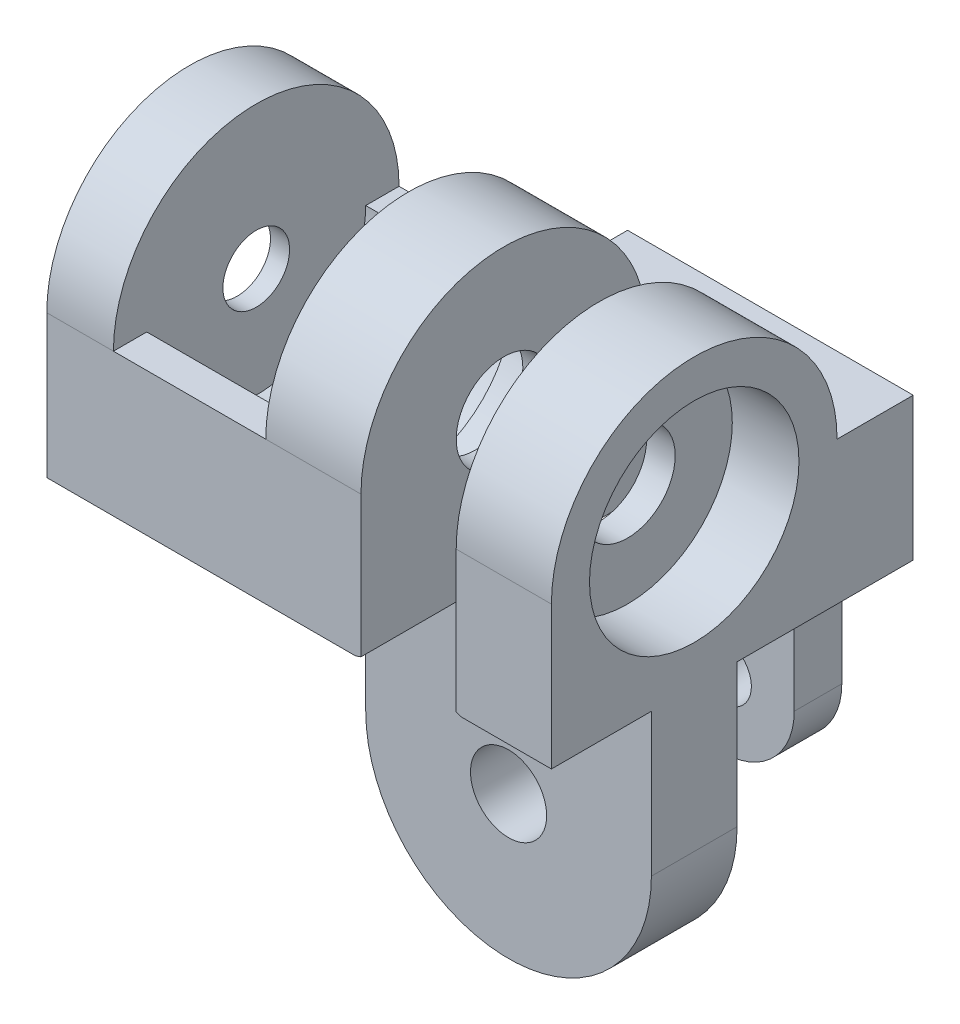
from build123d import *

# Parameters (mm, degrees)
SKETCH1_R           = 15
BOSS_EXTRUDE1_DEPTH = 30
SKETCH8_W           = 30
SKETCH8_H           = 15
REVOLVE1_ANGLE      = 180
SKETCH9_W           = 30
SKETCH9_H           = 30
BOSS_EXTRUDE3_DEPTH = 15
SKETCH10_R          = 5
CUT_EXTRUDE1_DEPTH  = 30
SKETCH13_R          = 16
CUT_EXTRUDE2_DEPTH  = 10
SKETCH14_W          = 10
SKETCH14_H          = 15
CUT_EXTRUDE3_DEPTH  = 67
CUT_EXTRUDE4_START  = -7
SKETCH15_R          = 11
SKETCH15_R_2        = 5
CUT_EXTRUDE4_DEPTH  = 7
SKETCH16_R          = 11
SKETCH16_R_2        = 5
CUT_EXTRUDE5_DEPTH  = 7
SKETCH17_R          = 15
SKETCH17_R_2        = 8
SKETCH17_R_3        = 3.5
BOSS_EXTRUDE4_DEPTH = 2
BOSS_EXTRUDE5_DEPTH = 5
BOSS_EXTRUDE6_DEPTH = 16
SKETCH21_W          = 53
SKETCH21_H          = 30
CUT_EXTRUDE7_DEPTH  = 20
SKETCH23_W          = 15
SKETCH23_H          = 9
SKETCH24_W          = 30
SKETCH24_H          = 9
BOSS_EXTRUDE7_DEPTH = 15
SKETCH25_R          = 4
CUT_EXTRUDE8_DEPTH  = 15
BOSS_EXTRUDE8_START = 3
SKETCH26_W          = 10
SKETCH26_H          = 15
BOSS_EXTRUDE8_DEPTH = 5
SKETCH30_W          = 30
SKETCH30_H          = 15
BOSS_EXTRUDE9_DEPTH = 3
SKETCH27_R          = 16
CUT_EXTRUDE9_DEPTH  = 16
SKETCH28_R          = 16
CUT_EXTRUDE10_DEPTH = 10.5
SKETCH29_R          = 16
CUT_EXTRUDE12_DEPTH = 10


with BuildPart() as part:
    # Sketch1 → Boss-Extrude1 (new body)
    with BuildSketch(Plane(origin=(0, 0, 0), x_dir=(1, 0, 0), z_dir=(0, 1, 0))):
        with Locations(Location((0, 0, 0), (0, 0, 270))):
            Circle(SKETCH1_R)
    extrude(amount=BOSS_EXTRUDE1_DEPTH)

    # Sketch8 → Revolve1 (revolve)
    with BuildSketch(Plane(origin=(0, 30, 0), x_dir=(1, 0, 0), z_dir=(0, 1, 0))):
        with Locations((0, -7.5)):
            Rectangle(SKETCH8_W, SKETCH8_H)
    revolve(axis=Axis((15, 30, 0), (-1, 0, 0)), revolution_arc=REVOLVE1_ANGLE)

    # Sketch9 → Boss-Extrude3 (add)
    with BuildSketch(Plane.XZ.offset(-30)):
        Rectangle(SKETCH9_W, SKETCH9_H)
    extrude(amount=BOSS_EXTRUDE3_DEPTH)

    # Sketch10 → Cut-Extrude1 (cut)
    with BuildSketch(Plane(origin=(15, 0, 0), x_dir=(0, 0, -1), z_dir=(1, 0, 0))):
        with Locations((0, 30)):
            Circle(SKETCH10_R)
    extrude(amount=-CUT_EXTRUDE1_DEPTH, mode=Mode.SUBTRACT)

    # Sketch13 → Cut-Extrude2 (cut)
    with BuildSketch(Plane(origin=(5, 0, 0), x_dir=(0, 0, -1), z_dir=(1, 0, 0))):
        with Locations((0, 30)):
            Circle(SKETCH13_R)
    extrude(amount=-CUT_EXTRUDE2_DEPTH, mode=Mode.SUBTRACT)

    # Sketch14 → Cut-Extrude3 (cut)
    with BuildSketch(Plane.XY.offset(15)):
        with Locations((0, 22.5)):
            Rectangle(SKETCH14_W, SKETCH14_H)
    extrude(amount=-CUT_EXTRUDE3_DEPTH, mode=Mode.SUBTRACT)

    # Sketch15 → Cut-Extrude4 (cut)
    with BuildSketch(Plane.ZY.offset(15).offset(CUT_EXTRUDE4_START)):
        with Locations((0, 30)):
            Circle(SKETCH15_R)
        with Locations(Location((0, 30, 0), (0, 0, 180))):
            Circle(SKETCH15_R_2, mode=Mode.SUBTRACT)
    extrude(amount=CUT_EXTRUDE4_DEPTH, mode=Mode.SUBTRACT)

    # Sketch16 → Cut-Extrude5 (cut)
    with BuildSketch(Plane(origin=(15, 0, 0), x_dir=(0, 0, -1), z_dir=(1, 0, 0))):
        with Locations(Location((0, 30, 0), (0, 0, 180))):
            Circle(SKETCH16_R)
        with Locations((0, 30)):
            Circle(SKETCH16_R_2, mode=Mode.SUBTRACT)
    extrude(amount=-CUT_EXTRUDE5_DEPTH, mode=Mode.SUBTRACT)



with BuildPart() as body_2:
    # Sketch17 → Boss-Extrude4 (new body)
    # profile 1 of 4: a face of its own
    with BuildSketch(Plane.ZY.offset(31)):
        with Locations((0, 30)):
            Circle(SKETCH17_R)
        with Locations((0, 30)):
            Circle(SKETCH17_R_2, mode=Mode.SUBTRACT)
    # profile 2 of 4: a face of its own
    with BuildSketch(Plane.ZY.offset(31)):
        with Locations((0, 30)):
            Circle(SKETCH17_R_2)
        with Locations((0, 30)):
            Circle(SKETCH17_R_3, mode=Mode.SUBTRACT)
    # profile 3 of 4: a face of its own
    with BuildSketch(Plane.ZY.offset(31)):
        with BuildLine():
            ThreePointArc((0, 15), (-10.606601718, 19.393398282), (-15, 30))
            Line((-15, 30), (-15, 15))
            Line((-15, 15), (0, 15))
        make_face()
    # profile 4 of 4: a face of its own
    with BuildSketch(Plane.ZY.offset(31)):
        with BuildLine():
            Line((15, 15), (15, 30))
            ThreePointArc((15, 30), (10.606601718, 19.393398282), (0, 15))
            Line((0, 15), (15, 15))
        make_face()
    extrude(amount=BOSS_EXTRUDE4_DEPTH)

    # Sketch18 → Boss-Extrude5 (add)
    with BuildSketch(Plane.ZY.offset(33)):
        with BuildLine():
            ThreePointArc((-8.5, 30), (0, 38.5), (8.5, 30))
            Line((8.5, 30), (8.5, 15))
            Line((8.5, 15), (15, 15))
            Line((15, 15), (15, 30))
            ThreePointArc((15, 30), (0, 45), (-15, 30))
            Line((-15, 30), (-15, 15))
            Line((-15, 15), (-8.5, 15))
            Line((-8.5, 15), (-8.5, 30))
        make_face()
    extrude(amount=BOSS_EXTRUDE5_DEPTH)


with BuildPart() as part_1:
    add(part.part)

    add(body_2.part)  # Boss-Extrude6 merges body 2
    # Sketch20 → Boss-Extrude6 (add)
    with BuildSketch(Plane.ZY.offset(15)):
        with BuildLine():
            ThreePointArc((11.5, 30), (0, 18.5), (-11.5, 30))
            Line((-11.5, 30), (-15, 30))
            Line((-15, 30), (-15, 15))
            Line((-15, 15), (0, 15))
            Line((0, 15), (15, 15))
            Line((15, 15), (15, 30))
            Line((15, 30), (11.5, 30))
        make_face()
    extrude(amount=BOSS_EXTRUDE6_DEPTH)

    # Sketch21 → Cut-Extrude7 (cut)
    with BuildSketch(Plane.XZ.offset(-15)):
        with Locations((-11.5, 0)):
            Rectangle(SKETCH21_W, SKETCH21_H)
    extrude(amount=CUT_EXTRUDE7_DEPTH, mode=Mode.SUBTRACT)


with BuildPart() as cut_extrude7_piece_1:
    # of the separate pieces the step leaves, piece 1, a body of its own (cut_extrude7_pieces)
    add(part_1.part.solids().sort_by_distance((-31, 30, 15))[0])



with BuildPart() as cut_extrude7_piece_2:
    # of the separate pieces the step leaves, piece 2, a body of its own (cut_extrude7_pieces)
    add(part_1.part.solids().sort_by_distance((5, 15, -15))[0])


with BuildPart() as body_3:
    # Sketch23 → Revolve2 (revolve)
    with BuildSketch(Plane(origin=(0, 0, 0), x_dir=(-1, 0, 0), z_dir=(0, -1, 0)), mode=Mode.PRIVATE) as revolve2_sk:
        with Locations((-7.5, 0)):
            Rectangle(SKETCH23_W, SKETCH23_H)
    revolve(revolve2_sk.sketch.rotate(Axis((0, 0, 4.5), (0, 0, -1)), 90), axis=Axis((0, 0, 4.5), (0, 0, -1)))


with BuildPart() as cut_extrude7_piece_1_1:
    add(cut_extrude7_piece_1.part)

    add(cut_extrude7_piece_2.part)  # Boss-Extrude7 merges Cut-Extrude7 piece 2

    add(body_3.part)  # Boss-Extrude7 merges body 3
    # Sketch24 → Boss-Extrude7 (add)
    with BuildSketch(Plane.XZ.offset(-15)):
        Rectangle(SKETCH24_W, SKETCH24_H)
    extrude(amount=BOSS_EXTRUDE7_DEPTH)

    # Sketch25 → Cut-Extrude8 (cut)
    with BuildSketch(Plane.XY.offset(4.5)):
        Circle(SKETCH25_R)
    extrude(amount=-CUT_EXTRUDE8_DEPTH, mode=Mode.SUBTRACT)



with BuildPart() as body_2_2:
    # Sketch26 → Boss-Extrude8 (new body)
    with BuildSketch(Plane(origin=(0, 0, -15), x_dir=(-1, 0, 0), z_dir=(0, 0, -1)).offset(BOSS_EXTRUDE8_START)):
        with Locations((-10, 22.5)):
            Rectangle(SKETCH26_W, SKETCH26_H)
        with BuildLine():
            Line((15, 30), (-5, 30))
            Line((-5, 30), (-5, 15))
            Line((-5, 15), (-12.5, 15))
            ThreePointArc((-12.5, 15), (-8.964466094, 13.535533906), (-7.5, 10))
            Line((-7.5, 10), (-7.5, 0))
            ThreePointArc((-7.5, 0), (0, 7.5), (7.5, 0))
            Line((7.5, 0), (7.5, 10))
            ThreePointArc((7.5, 10), (8.964466094, 13.535533906), (12.5, 15))
            Line((12.5, 15), (15, 15))
            Line((15, 15), (15, 30))
        make_face()
        with BuildLine():
            ThreePointArc((7.5, 0), (0, 7.5), (-7.5, 0))
            Line((-7.5, 0), (-3, 0))
            ThreePointArc((-3, 0), (0, 3), (3, 0))
            Line((3, 0), (7.5, 0))
        make_face()
        with BuildLine():
            Line((-3, 0), (-7.5, 0))
            ThreePointArc((-7.5, 0), (0, -7.5), (7.5, 0))
            Line((7.5, 0), (3, 0))
            ThreePointArc((3, 0), (0, -3), (-3, 0))
        make_face()
    extrude(amount=BOSS_EXTRUDE8_DEPTH)


with BuildPart() as cut_extrude7_piece_1_2:
    add(cut_extrude7_piece_1_1.part)

    add(body_2_2.part)  # Boss-Extrude9 merges body 2 2
    # Sketch30 → Boss-Extrude9 (add)
    with BuildSketch(Plane.XY.offset(-18)):
        with Locations((0, 22.5)):
            Rectangle(SKETCH30_W, SKETCH30_H)
    extrude(amount=BOSS_EXTRUDE9_DEPTH)

    # Sketch27 → Cut-Extrude9 (cut)
    with BuildSketch(Plane.XY.offset(4.5)):
        Circle(SKETCH27_R)
    extrude(amount=CUT_EXTRUDE9_DEPTH, mode=Mode.SUBTRACT)

    # Sketch28 → Cut-Extrude10 (cut)
    with BuildSketch(Plane(origin=(0, 0, -4.5), x_dir=(-1, 0, 0), z_dir=(0, 0, -1))):
        Circle(SKETCH28_R)
    extrude(amount=CUT_EXTRUDE10_DEPTH, mode=Mode.SUBTRACT)

    # Sketch29 → Cut-Extrude12 (cut)
    with BuildSketch(Plane.ZY.offset(-5)):
        with Locations((0, 30)):
            Circle(SKETCH29_R)
    extrude(amount=CUT_EXTRUDE12_DEPTH, mode=Mode.SUBTRACT)


solid = cut_extrude7_piece_1_2.part
